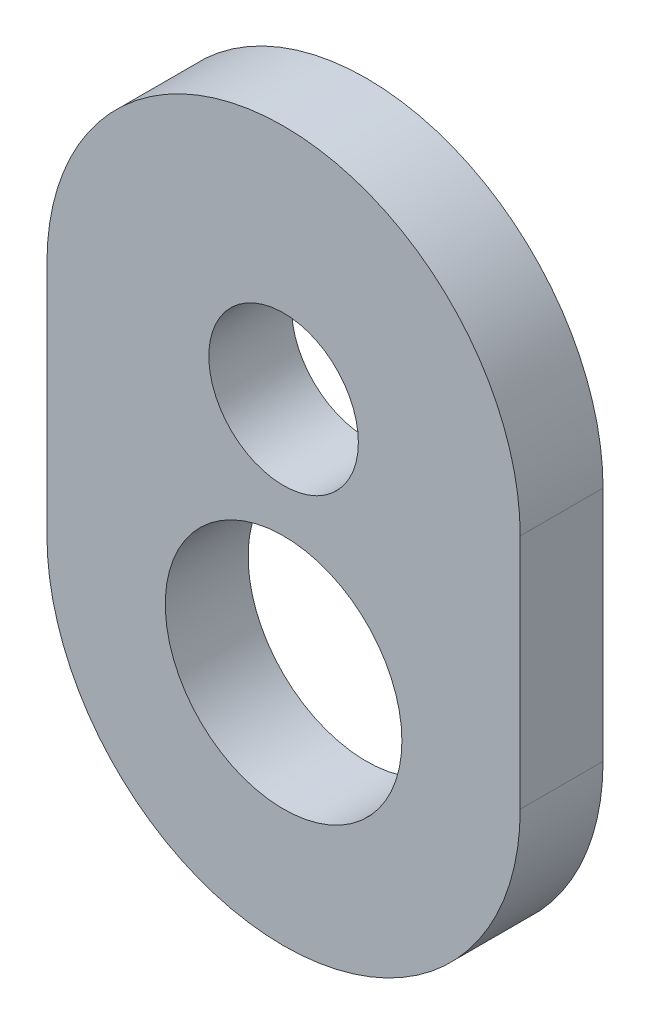
from build123d import *

# Parameters (mm, degrees)
BOSS_EXTRUDE1_DEPTH = 8.89
SKETCH2_R           = 12.7
SKETCH2_R_2         = 8.0264
CUT_EXTRUDE2_DEPTH  = 73.39


with BuildPart() as part:
    # Sketch1 → Boss-Extrude1 (new body)
    with BuildSketch(Plane.XY):
        with BuildLine():
            Line((0, 0), (0, 25.4))
            ThreePointArc((0, 25.4), (25.4, 50.8), (50.8, 25.4))
            Line((50.8, 25.4), (50.8, 0))
            ThreePointArc((50.8, 0), (25.4, -25.4), (0, 0))
        make_face()
    extrude(amount=BOSS_EXTRUDE1_DEPTH)

    # Sketch2 → Cut-Extrude2 (cut, through all)
    with BuildSketch(Plane.XY.offset(8.89)):
        with Locations((25.4, 0)):
            Circle(SKETCH2_R)
        with Locations((25.4, 25.4)):
            Circle(SKETCH2_R_2)
    extrude(amount=-CUT_EXTRUDE2_DEPTH, mode=Mode.SUBTRACT)


solid = part.part
